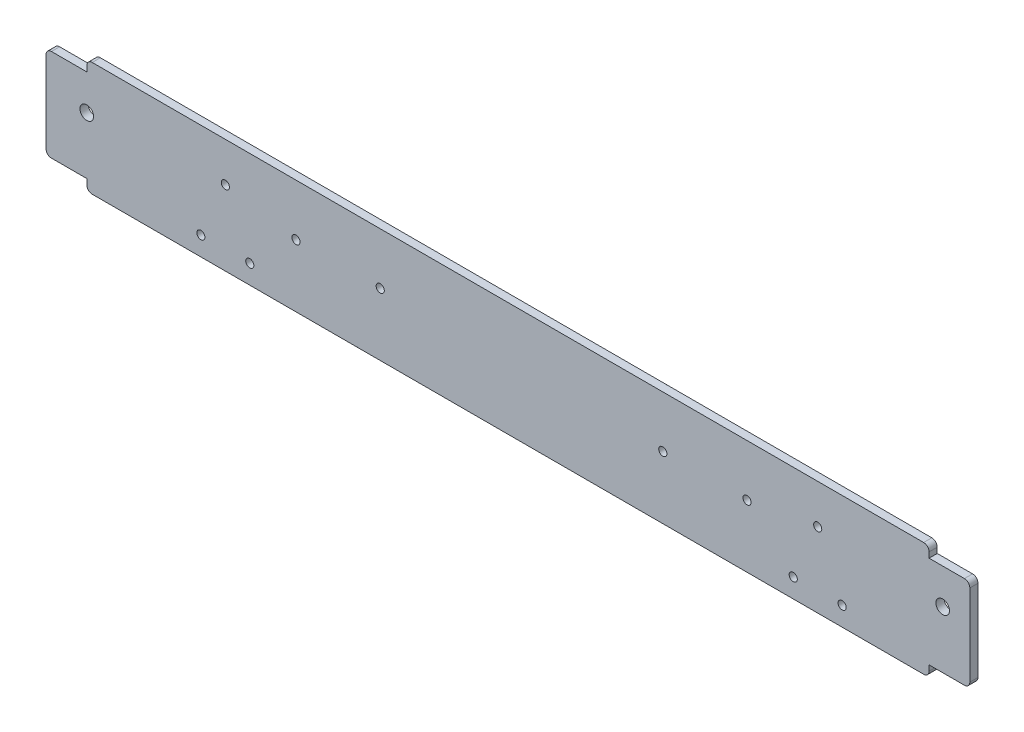
from build123d import *

# Parameters (mm, degrees)
CROQUIS1_W                                 = 340
CROQUIS1_H                                 = 42
CROQUIS1_R                                 = 1.5
CROQUIS1_R_2                               = 2.5
SALIENTE_EXTRUIR1_DEPTH                    = 3
CROQUIS2_W                                 = 15
CROQUIS2_H                                 = 4
CORTAR_EXTRUIR2_DEPTH                      = 172.31841699
SIMETR_A4_AT_THE_SECOND_PLANE_COPY_1_SKE_W = 15
SIMETR_A4_AT_THE_SECOND_PLANE_COPY_1_SKE_H = 4
SIMETR_A4_AT_THE_SECOND_PLANE_COPY_1_DEPTH = 172.31841699
REDONDEO1_R                                = 2


with BuildPart() as part:
    # Croquis1 → Saliente-Extruir1 (new body)
    with BuildSketch(Plane.XY):
        Rectangle(CROQUIS1_W, CROQUIS1_H)
        with Locations((-47, 2)):
            Circle(CROQUIS1_R, mode=Mode.SUBTRACT)
        with Locations((-78, 2)):
            Circle(CROQUIS1_R, mode=Mode.SUBTRACT)
        with Locations((-104, 6.5)):
            Circle(CROQUIS1_R, mode=Mode.SUBTRACT)
        with Locations((-113, -14)):
            Circle(CROQUIS1_R, mode=Mode.SUBTRACT)
        with Locations((-95, -14)):
            Circle(CROQUIS1_R, mode=Mode.SUBTRACT)
        with Locations((-155, 4)):
            Circle(CROQUIS1_R_2, mode=Mode.SUBTRACT)
        with Locations((160, 4)):
            Circle(CROQUIS1_R_2, mode=Mode.SUBTRACT)
        with Locations((114, 6.5)):
            Circle(CROQUIS1_R, mode=Mode.SUBTRACT)
        with Locations((105, -14)):
            Circle(CROQUIS1_R, mode=Mode.SUBTRACT)
        with Locations((123, -14)):
            Circle(CROQUIS1_R, mode=Mode.SUBTRACT)
        with Locations((88, 2)):
            Circle(CROQUIS1_R, mode=Mode.SUBTRACT)
        with Locations((57, 2)):
            Circle(CROQUIS1_R, mode=Mode.SUBTRACT)
    extrude(amount=SALIENTE_EXTRUIR1_DEPTH)

    # Croquis2 → Cortar-Extruir2 (cut, through all)
    with BuildSketch(Plane.XY.offset(3)):
        with Locations((-162.5, -19)):
            Rectangle(CROQUIS2_W, CROQUIS2_H)
    cortar_extruir2 = extrude(amount=-CORTAR_EXTRUIR2_DEPTH, mode=Mode.SUBTRACT)

    # Simetría4: Cortar-Extruir2 across plane
    add(cortar_extruir2.mirror(Plane(origin=(0, 0, 0), x_dir=(0, 0, 1), z_dir=(1, 0, 0))), mode=Mode.SUBTRACT)

    # Simetría4 at the second plane: Cortar-Extruir2 across plane
    add(cortar_extruir2.mirror(Plane.ZX), mode=Mode.SUBTRACT)

    # Simetría4 at the second plane copy 1 ske → Simetría4 at the second plane copy 1 (cut, through all)
    with BuildSketch(Plane(origin=(0, 0, 3), x_dir=(-1, 0, 0), z_dir=(0, 0, 1))):
        with Locations((-162.5, -19)):
            Rectangle(SIMETR_A4_AT_THE_SECOND_PLANE_COPY_1_SKE_W, SIMETR_A4_AT_THE_SECOND_PLANE_COPY_1_SKE_H)
    extrude(amount=-SIMETR_A4_AT_THE_SECOND_PLANE_COPY_1_DEPTH, mode=Mode.SUBTRACT)

    # Redondeo1
    redondeo1_edges = [part.edges().sort_by_distance(p)[0] for p in [
        (155, -21, 1.5),
        (170, 17, 1.5),
        (155, 21, 1.5),
        (-170, -17, 1.5),
        (-155, -21, 1.5),
        (-170, 17, 1.5),
        (-155, 21, 1.5),
        (170, -17, 1.5),
    ]]
    fillet(redondeo1_edges, radius=REDONDEO1_R)


solid = part.part
